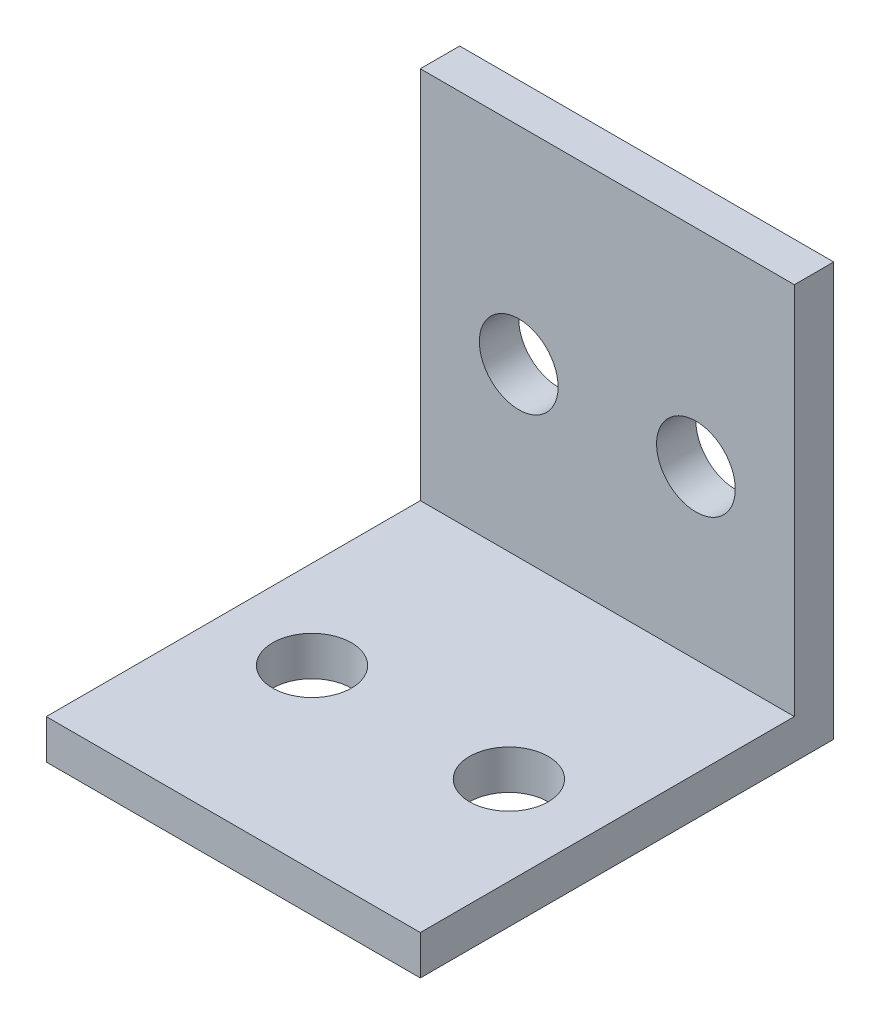
from build123d import *

# Parameters (mm, degrees)
SKETCH1_W           = 19
SKETCH1_H           = 21
BOSS_EXTRUDE1_DEPTH = 2
SKETCH3_W           = 19
SKETCH3_H           = 2
BOSS_EXTRUDE3_DEPTH = 19
SKETCH6_R           = 2
CUT_EXTRUDE1_DEPTH  = 2
SKETCH7_R           = 2
CUT_EXTRUDE2_DEPTH  = 2


with BuildPart() as part:
    # Sketch1 → Boss-Extrude1 (new body)
    with BuildSketch(Plane.XY):
        Rectangle(SKETCH1_W, SKETCH1_H)
    extrude(amount=BOSS_EXTRUDE1_DEPTH)

    # Sketch3 → Boss-Extrude3 (add)
    with BuildSketch(Plane.XY.offset(2)):
        with Locations((0, -9.5)):
            Rectangle(SKETCH3_W, SKETCH3_H)
    extrude(amount=BOSS_EXTRUDE3_DEPTH)

    # Sketch6 → Cut-Extrude1 (cut)
    with BuildSketch(Plane.XY.offset(2)):
        with Locations((-4.5, 0)):
            Circle(SKETCH6_R)
        with Locations(Location((4.5, 0, 0), (0, 0, 180))):
            Circle(SKETCH6_R)
    extrude(amount=-CUT_EXTRUDE1_DEPTH, mode=Mode.SUBTRACT)

    # Sketch7 → Cut-Extrude2 (cut)
    with BuildSketch(Plane(origin=(0, -8.5, 0), x_dir=(1, 0, 0), z_dir=(0, 1, 0))):
        with Locations(Location((-5, -12, 0), (0, 0, 180))):
            Circle(SKETCH7_R)
        with Locations((5, -12)):
            Circle(SKETCH7_R)
    extrude(amount=-CUT_EXTRUDE2_DEPTH, mode=Mode.SUBTRACT)


solid = part.part
